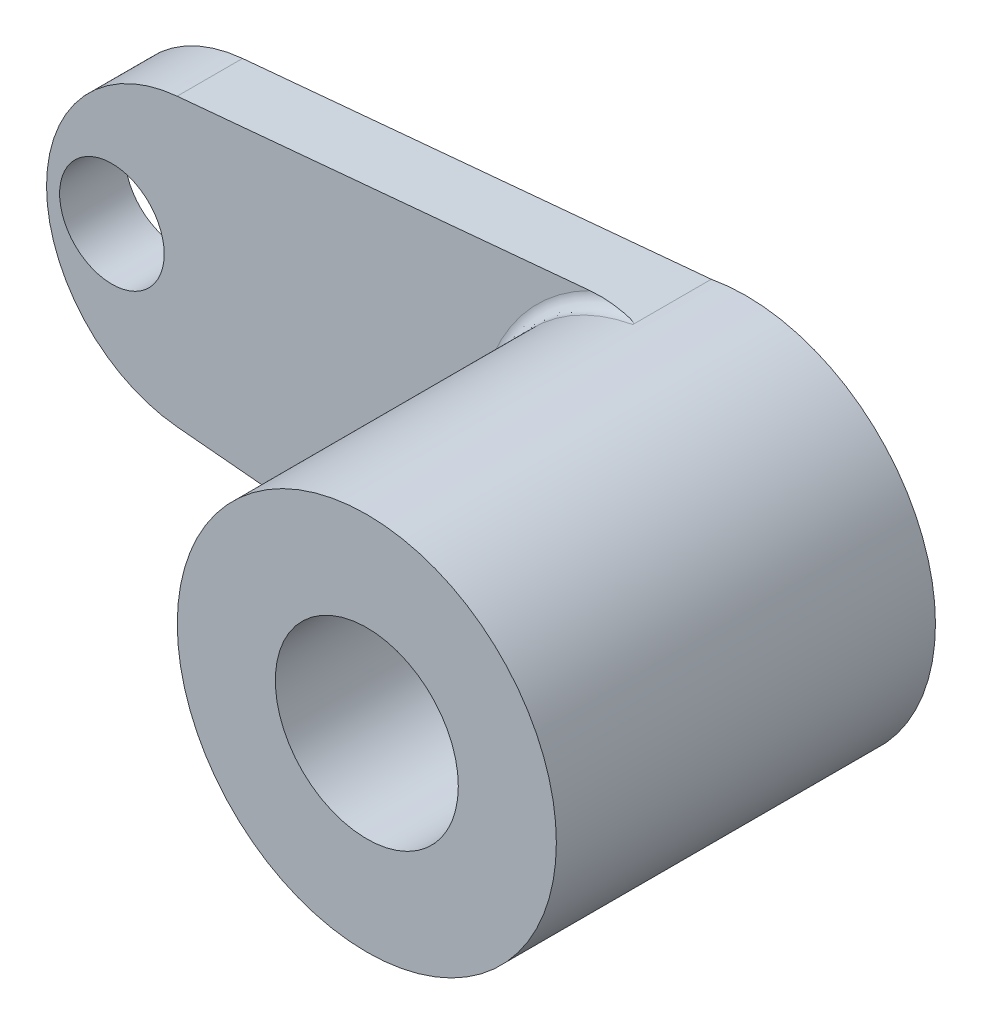
from build123d import *

# Parameters (mm, degrees)
SKETCH2_R           = 14.5
BOSS_EXTRUDE1_DEPTH = 29
SKETCH5_R           = 4
BOSS_EXTRUDE2_DEPTH = 5
FILLET1_R           = 1
SKETCH8_R           = 7
CUT_EXTRUDE1_DEPTH  = 25


with BuildPart() as part:
    # Sketch2 → Boss-Extrude1 (new body)
    with BuildSketch(Plane.XY):
        with Locations(Location((0, 0, 0), (0, 0, 180))):
            Circle(SKETCH2_R)
    extrude(amount=BOSS_EXTRUDE1_DEPTH)

    # Sketch5 → Boss-Extrude2 (add)
    with BuildSketch(Plane.XY):
        with BuildLine():
            Line((0, 14.5), (0, -14.5))
            Line((0, -14.5), (-38.508744426, -10.953649377))
            ThreePointArc((-38.508744426, -10.953649377), (-48.5, 0), (-38.508744426, 10.953649377))
            Line((-38.508744426, 10.953649377), (0, 14.5))
        make_face()
        with Locations((-43.5, 0)):
            Circle(SKETCH5_R, mode=Mode.SUBTRACT)
    extrude(amount=BOSS_EXTRUDE2_DEPTH)

    # Fillet1
    fillet1_edges = [part.edges().sort_by_distance(p)[0] for p in [
        (-11.15009107, -9.269599189, 5),
    ]]
    fillet(fillet1_edges, radius=FILLET1_R)

    # Sketch8 → Cut-Extrude1 (cut)
    with BuildSketch(Plane.XY.offset(29)):
        Circle(SKETCH8_R)
    extrude(amount=-CUT_EXTRUDE1_DEPTH, mode=Mode.SUBTRACT)


solid = part.part
